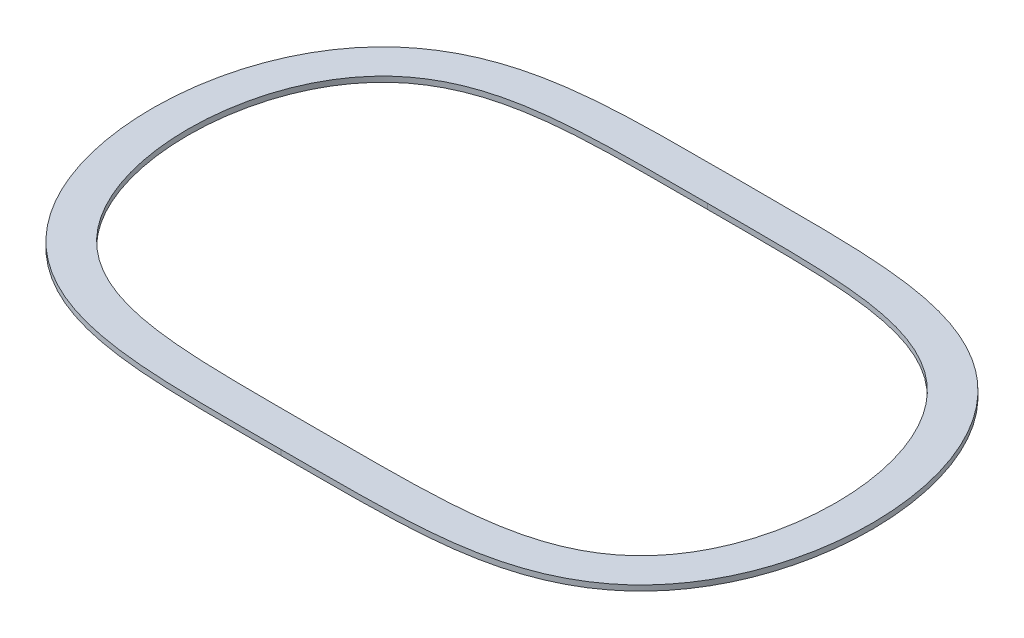
from build123d import *

# Parameters (mm, degrees)
BODY_DEPTH       = 3
CUT_INSIDE_DEPTH = 50


with BuildPart() as part:
    # Sketch1 → body (new body)
    with BuildSketch(Plane(origin=(0, 0, 0), x_dir=(1, 0, 0), z_dir=(0, 1, 0))):
        with BuildLine():
            add(Edge.make_bspline(
                [(0, 129.099444874), (4.329825716, 129.099856757), (12.989477034, 129.099521717), (25.976301205, 129.099245615), (43.290249676, 129.013980379), (60.600663959, 128.671189087), (77.894655735, 127.812916551), (95.543037977, 126.045988358), (113.01399335, 122.896019952), (130.046357946, 117.797143556), (146.158139311, 110.226946457), (160.431314667, 100.265018203), (172.693338202, 87.911885541), (182.663351285, 73.663423027), (190.340438043, 58.079107996), (195.865426103, 41.62272021), (199.400795759, 24.636185909), (201.069948812, 7.370686111), (200.935166589, -9.973525735), (198.991239132, -27.210718658), (195.166319776, -44.135428769), (189.328734448, -60.48538478), (181.314677982, -75.901802403), (170.994375318, -89.90233662), (157.866189481, -102.437720294), (141.967900724, -112.68294779), (124.642016349, -119.756709815), (106.708377896, -124.219228333), (88.446200884, -126.903428265), (70.051310284, -128.322663007), (45.62975056, -129.099776243), (25.349069661, -129.099346893), (10.139933531, -129.099445048), (-2.223e-06, -129.099444874)],
                knots=[0, 0, 0, 0, 0, 0.03122023, 0.062440461, 0.093641547, 0.124842633, 0.156052703, 0.187262773, 0.221451125, 0.252661674, 0.283871788, 0.315081907, 0.34629216, 0.377502474, 0.408712793, 0.439923128, 0.471133499, 0.502343874, 0.533554233, 0.564764591, 0.595974957, 0.627185296, 0.658395569, 0.689605838, 0.720816286, 0.757370802, 0.793925658, 0.823852077, 0.853778496, 0.890332223, 0.92688595, 1, 1, 1, 1, 1], degree=4))
            add(Edge.make_bspline(
                [(0, 129.099444874), (-4.329825716, 129.099856832), (-12.989477034, 129.099521941), (-25.976301205, 129.099246062), (-43.290249678, 129.013981124), (-60.600663967, 128.67119013), (-77.894655757, 127.812917893), (-95.543038029, 126.045990003), (-113.013993457, 122.896021898), (-130.04635814, 117.797145795), (-146.158139636, 110.226948973), (-160.431315164, 100.265020966), (-172.693338911, 87.911888514), (-182.663352239, 73.663426172), (-190.340439266, 58.079111273), (-195.865427609, 41.622723582), (-199.400797558, 24.636189342), (-201.069950908, 7.370689573), (-200.935168983, -9.973522276), (-198.991241823, -27.210715232), (-195.166322759, -44.135425409), (-189.328737713, -60.48538152), (-181.314681512, -75.901799281), (-170.994379089, -89.902333676), (-157.866193468, -102.437717576), (-141.967904887, -112.682945345), (-124.642020634, -119.756707669), (-106.708382258, -124.219226496), (-88.446205291, -126.903426743), (-70.051314717, -128.322661801), (-45.629755005, -129.099775457), (-25.349074106, -129.099346457), (-10.139937977, -129.099444874), (-2.223e-06, -129.099444874)],
                knots=[0, 0, 0, 0, 0, 0.03122023, 0.062440461, 0.093641547, 0.124842633, 0.156052703, 0.187262773, 0.221451125, 0.252661674, 0.283871788, 0.315081907, 0.34629216, 0.377502474, 0.408712793, 0.439923128, 0.471133499, 0.502343874, 0.533554233, 0.564764591, 0.595974957, 0.627185296, 0.658395569, 0.689605838, 0.720816286, 0.757370802, 0.793925658, 0.823852077, 0.853778496, 0.890332223, 0.92688595, 1, 1, 1, 1, 1], degree=4))
        make_face()
    extrude(amount=BODY_DEPTH)

    # Sketch6 → cut-inside (cut)
    with BuildSketch(Plane(origin=(0, 3, 0), x_dir=(1, 0, 0), z_dir=(0, 1, 0))):
        with BuildLine():
            add(Edge.make_bspline(
                [(-1.878e-06, -109.099444874), (5.124131252, -109.099444962), (10.248290672, -109.100172116), (20.496342874, -109.0942524), (25.620236603, -109.087631748), (35.866779566, -109.039973377), (40.989430956, -108.998995259), (51.231808363, -108.836136562), (56.351538877, -108.714380332), (66.58558723, -108.321177898), (71.699916203, -108.050039625), (81.919658597, -107.261199505), (87.02508834, -106.74394902), (94.672850379, -105.68093854), (97.220365628, -105.278128693), (102.277245483, -104.360661731), (104.790373546, -103.845565367), (112.275123964, -102.099169668), (117.19241076, -100.667861453), (123.213386036, -98.41627102), (124.411266443, -97.942708747), (126.793329359, -96.945162323), (127.977762841, -96.420876022), (131.478507271, -94.781221381), (133.752256129, -93.594958047), (140.381145654, -89.737902377), (144.54348395, -86.768153858), (149.392044414, -82.506499699), (150.345882081, -81.624845659), (152.197946626, -79.825804808), (153.098469339, -78.906589635), (155.726088228, -76.091851336), (157.379257017, -74.139252305), (160.501005231, -70.091541365), (161.969687223, -67.996508642), (164.042708441, -64.753591226), (164.712018001, -63.655867111), (166.00833446, -61.427758963), (166.636603785, -60.294882086), (169.653602687, -54.591487927), (171.680965444, -49.896555592), (175.10166196, -40.289649171), (176.49405417, -35.377352772), (177.878500625, -29.115100828), (178.137449529, -27.856509059), (178.619974615, -25.327216679), (178.843610006, -24.055773513), (179.458526856, -20.246697331), (179.79548458, -17.706789635), (180.599090499, -10.085579702), (180.859938141, -5.002801145), (180.854227483, 5.166539345), (180.587702182, 10.253101041), (179.773296878, 17.885917864), (179.432355652, 20.430688506), (178.603231918, 25.521286032), (178.118638937, 28.0447742), (176.449643416, 35.544634393), (175.051745975, 40.452515457), (172.473456628, 47.659007751), (171.53331529, 50.035131664), (169.990495314, 53.556533869), (169.454083017, 54.723191849), (168.334494285, 57.041420169), (167.750142519, 58.195163181), (164.71868088, 63.8967241), (161.963018222, 68.213141228), (157.269358285, 74.272792365), (155.61103435, 76.223210193), (152.972533712, 79.036964244), (152.067849177, 79.956225552), (150.206131509, 81.755967989), (149.253599905, 82.631913379), (144.409898783, 86.868939186), (140.249155852, 89.825904017), (133.616384237, 93.668407156), (131.340259219, 94.85053115), (127.834525123, 96.485121461), (126.648664252, 97.007680186), (124.268492047, 98.000133517), (123.072064849, 98.471115591), (117.060664341, 100.709520728), (112.158460615, 102.129670005), (102.221325101, 104.441563701), (97.186103292, 105.332153509), (89.563639196, 106.390828108), (87.008901003, 106.697333717), (81.902120416, 107.231621908), (79.347601475, 107.459824683), (71.681342499, 108.051201582), (66.566928106, 108.322103295), (56.33377996, 108.714877363), (51.215039069, 108.836503445), (40.975221045, 108.999149088), (35.854139441, 109.040014377), (25.610985987, 109.087578881), (20.488912839, 109.094233273), (10.244558755, 109.100372842), (5.122279965, 109.09993205), (-1.72e-07, 109.099444783)],
                knots=[0, 0, 0, 0, 0.03125, 0.03125, 0.0625, 0.0625, 0.09375, 0.09375, 0.125, 0.125, 0.15625, 0.15625, 0.1875, 0.1875, 0.203125, 0.203125, 0.21875, 0.21875, 0.25, 0.25, 0.2578125, 0.2578125, 0.265625, 0.265625, 0.28125, 0.28125, 0.3125, 0.3125, 0.3203125, 0.3203125, 0.328125, 0.328125, 0.34375, 0.34375, 0.359375, 0.359375, 0.3671875, 0.3671875, 0.375, 0.375, 0.40625, 0.40625, 0.4375, 0.4375, 0.4453125, 0.4453125, 0.453125, 0.453125, 0.46875, 0.46875, 0.5, 0.5, 0.53125, 0.53125, 0.546875, 0.546875, 0.5625, 0.5625, 0.59375, 0.59375, 0.609375, 0.609375, 0.6171875, 0.6171875, 0.625, 0.625, 0.65625, 0.65625, 0.671875, 0.671875, 0.6796875, 0.6796875, 0.6875, 0.6875, 0.71875, 0.71875, 0.734375, 0.734375, 0.7421875, 0.7421875, 0.75, 0.75, 0.78125, 0.78125, 0.8125, 0.8125, 0.828125, 0.828125, 0.84375, 0.84375, 0.875, 0.875, 0.90625, 0.90625, 0.9375, 0.9375, 0.96875, 0.96875, 1, 1, 1, 1], degree=3))
            add(Edge.make_bspline(
                [(-1.72e-07, 109.099444783), (-5.124132646, 109.099932315), (-10.248263461, 109.100373952), (-20.496270795, 109.09422606), (-25.620144622, 109.08756207), (-35.866651664, 109.039931567), (-40.989286461, 108.999008802), (-51.231626365, 108.836158207), (-56.351336961, 108.714382168), (-66.585347208, 108.321219154), (-71.699655542, 108.05007224), (-81.919352732, 107.261157641), (-87.024761048, 106.743927984), (-94.672491649, 105.681027942), (-97.220022728, 105.278282406), (-102.27691231, 104.360891564), (-104.790014291, 103.845731617), (-112.274631935, 102.098988196), (-117.192064223, 100.668367382), (-123.212909208, 98.416587882), (-124.410746516, 97.942930134), (-126.792730991, 96.945232258), (-127.977159008, 96.420901381), (-131.478017218, 94.781298086), (-133.751941795, 93.595240262), (-140.381000633, 89.73829904), (-144.543149929, 86.768229193), (-149.39177205, 82.506732288), (-150.345642665, 81.625095554), (-152.197756549, 79.826029631), (-153.09827916, 78.906787189), (-155.725912715, 76.091991352), (-159.032360484, 72.186820432), (-161.969612899, 67.996674402), (-164.042562236, 64.753728005), (-164.711857048, 63.656005072), (-166.008172503, 61.427928552), (-166.636458736, 60.295077758), (-169.653621127, 54.591637604), (-171.680935681, 49.896647771), (-175.101663399, 40.28973659), (-176.49400715, 35.377449273), (-177.878466193, 29.115271099), (-178.137416444, 27.856695567), (-178.619941928, 25.327438589), (-178.843581858, 24.055985506), (-179.458511787, 20.246859981), (-179.79547406, 17.706925663), (-180.599087527, 10.085653725), (-180.859931983, 5.002857515), (-180.854238361, -5.166472562), (-180.587710535, -10.253006357), (-179.773316402, -17.885745412), (-179.432381147, -20.430484115), (-178.603278777, -25.521004979), (-178.118673707, -28.044600576), (-176.449693651, -35.544546001), (-175.051744651, -40.452439584), (-172.47347527, -47.658940979), (-171.533347639, -50.035063315), (-169.990525471, -53.556444498), (-169.45411077, -54.723093041), (-168.334534133, -57.041303953), (-167.75020728, -58.195032102), (-164.718829162, -63.89669026), (-161.962962529, -68.212957091), (-157.269456137, -74.272676679), (-155.611181502, -76.223108138), (-152.972679485, -79.036814278), (-152.067989399, -79.95605375), (-150.206309879, -81.755784655), (-149.253791058, -82.631764587), (-144.410182341, -86.868906136), (-140.249242667, -89.825541299), (-133.616608465, -93.668187674), (-131.340641565, -94.850526606), (-127.834968617, -96.485168823), (-126.649082464, -97.007680744), (-124.268851478, -97.999964955), (-123.072391951, -98.470848492), (-117.060907386, -100.709059375), (-112.158850797, -102.129873413), (-102.221568371, -104.441292445), (-97.186379123, -105.332043118), (-89.563934748, -106.390818085), (-87.009194472, -106.697348926), (-81.902395034, -107.231660372), (-79.347866209, -107.459850722), (-71.68157758, -108.051170584), (-66.567145019, -108.32206342), (-56.333963088, -108.714876228), (-51.215204618, -108.836482175), (-40.975353327, -108.999135791), (-35.854256824, -109.040056384), (-25.61107138, -109.087648541), (-20.488980681, -109.094259494), (-10.244587446, -109.100170886), (-5.122284143, -109.099444874), (-1.878e-06, -109.099444874)],
                knots=[0, 0, 0, 0, 0.03125, 0.03125, 0.0625, 0.0625, 0.09375, 0.09375, 0.125, 0.125, 0.15625, 0.15625, 0.1875, 0.1875, 0.203125, 0.203125, 0.21875, 0.21875, 0.25, 0.25, 0.2578125, 0.2578125, 0.265625, 0.265625, 0.28125, 0.28125, 0.3125, 0.3125, 0.3203125, 0.3203125, 0.328125, 0.328125, 0.34375, 0.359375, 0.359375, 0.3671875, 0.3671875, 0.375, 0.375, 0.40625, 0.40625, 0.4375, 0.4375, 0.4453125, 0.4453125, 0.453125, 0.453125, 0.46875, 0.46875, 0.5, 0.5, 0.53125, 0.53125, 0.546875, 0.546875, 0.5625, 0.5625, 0.59375, 0.59375, 0.609375, 0.609375, 0.6171875, 0.6171875, 0.625, 0.625, 0.65625, 0.65625, 0.671875, 0.671875, 0.6796875, 0.6796875, 0.6875, 0.6875, 0.71875, 0.71875, 0.734375, 0.734375, 0.7421875, 0.7421875, 0.75, 0.75, 0.78125, 0.78125, 0.8125, 0.8125, 0.828125, 0.828125, 0.84375, 0.84375, 0.875, 0.875, 0.90625, 0.90625, 0.9375, 0.9375, 0.96875, 0.96875, 1, 1, 1, 1], degree=3))
        make_face()
    extrude(amount=-CUT_INSIDE_DEPTH, mode=Mode.SUBTRACT)


solid = part.part
